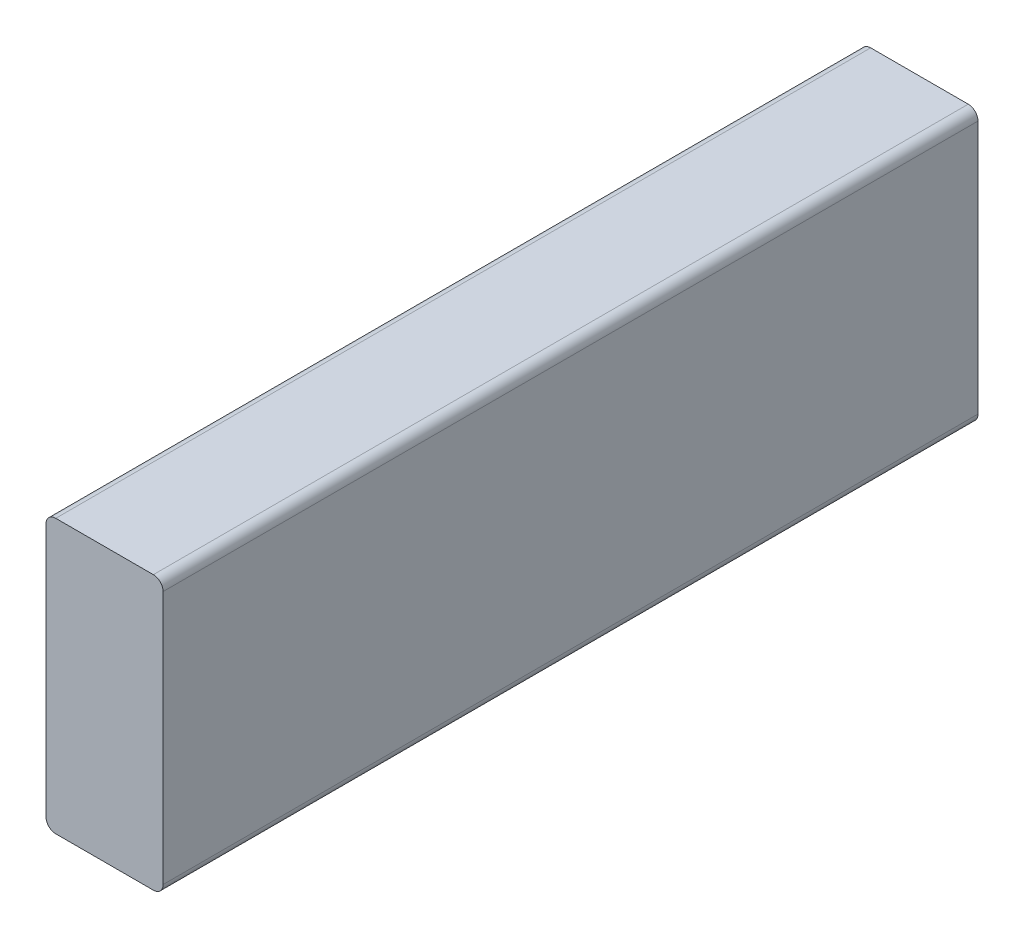
from build123d import *

# Parameters (mm, degrees)
SKETCH1_W           = 38.1
SKETCH1_H           = 88.9
BOSS_EXTRUDE1_DEPTH = 265.1125
FILLET1_R           = 3.175


with BuildPart() as part:
    # Sketch1 → Boss-Extrude1 (new body)
    with BuildSketch(Plane.XY):
        with Locations((19.05, 44.45)):
            Rectangle(SKETCH1_W, SKETCH1_H)
    extrude(amount=-BOSS_EXTRUDE1_DEPTH)

    # Fillet1
    fillet1_edges = [part.edges().sort_by_distance(p)[0] for p in [
        (0, 88.9, -132.55625),
        (38.1, 88.9, -132.55625),
        (38.1, 0, -132.55625),
        (0, 0, -132.55625),
    ]]
    fillet(fillet1_edges, radius=FILLET1_R)


solid = part.part
